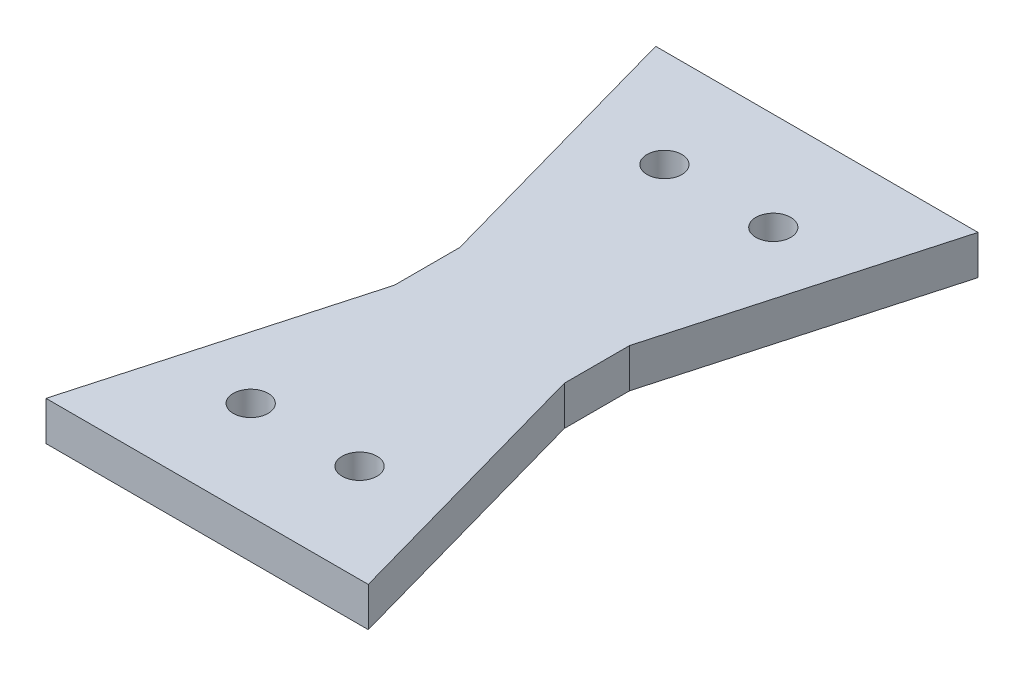
from build123d import *

# Parameters (mm, degrees)
SKETCH1_R           = 4
BOSS_EXTRUDE1_DEPTH = 9


with BuildPart() as part:
    # Sketch1 → Boss-Extrude1 (new body)
    with BuildSketch(Plane(origin=(0, 0, 0), x_dir=(1, 0, 0), z_dir=(0, 1, 0))):
        Polygon((-37, 70), (-30, 45), (-19.5, 7.5), (-19.5, -7.5), (-30, -45), (-37, -70), (37, -70), (30, -45), (19.5, -7.5), (19.5, 7.5), (30, 45), (37, 70), align=None)
        with Locations(Location((-12.5, 47.5, 0), (0, 0, 270))):
            Circle(SKETCH1_R, mode=Mode.SUBTRACT)
        with Locations(Location((12.5, 47.5, 0), (0, 0, 90))):
            Circle(SKETCH1_R, mode=Mode.SUBTRACT)
        with Locations(Location((12.5, -47.5, 0), (0, 0, 270))):
            Circle(SKETCH1_R, mode=Mode.SUBTRACT)
        with Locations(Location((-12.5, -47.5, 0), (0, 0, 90))):
            Circle(SKETCH1_R, mode=Mode.SUBTRACT)
    extrude(amount=BOSS_EXTRUDE1_DEPTH)


solid = part.part
